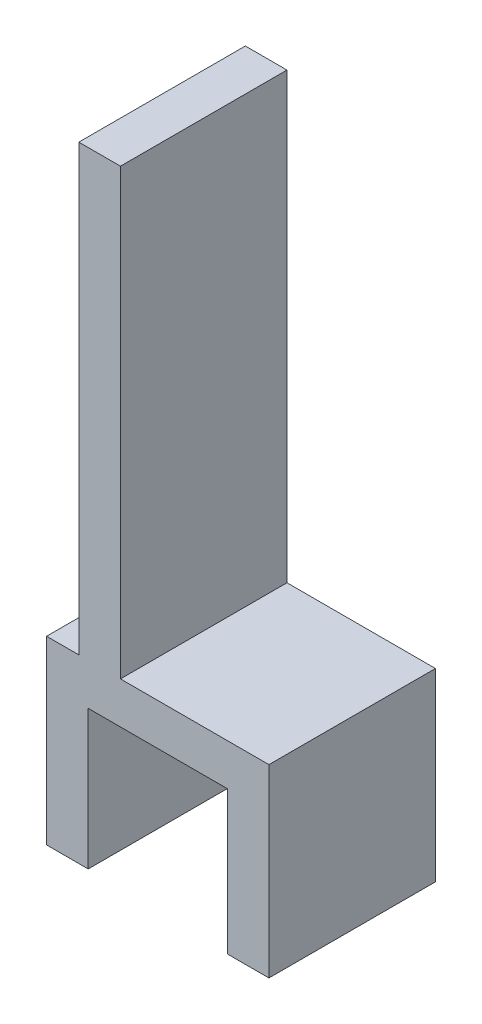
from build123d import *

# Parameters (mm, degrees)
BOSS_EXTRUDE1_DEPTH = 12


with BuildPart() as part:
    # Sketch1 → Boss-Extrude1 (new body)
    with BuildSketch(Plane.XY):
        Polygon((0, -13.025), (0, 0), (2.325, 0), (2.325, 32), (5.325, 32), (5.325, 0), (16.025, 0), (16.025, -13.316990291), (13.025, -13.316990291), (13.025, -3), (3, -3), (3, -13.025), align=None)
    extrude(amount=BOSS_EXTRUDE1_DEPTH)


solid = part.part
